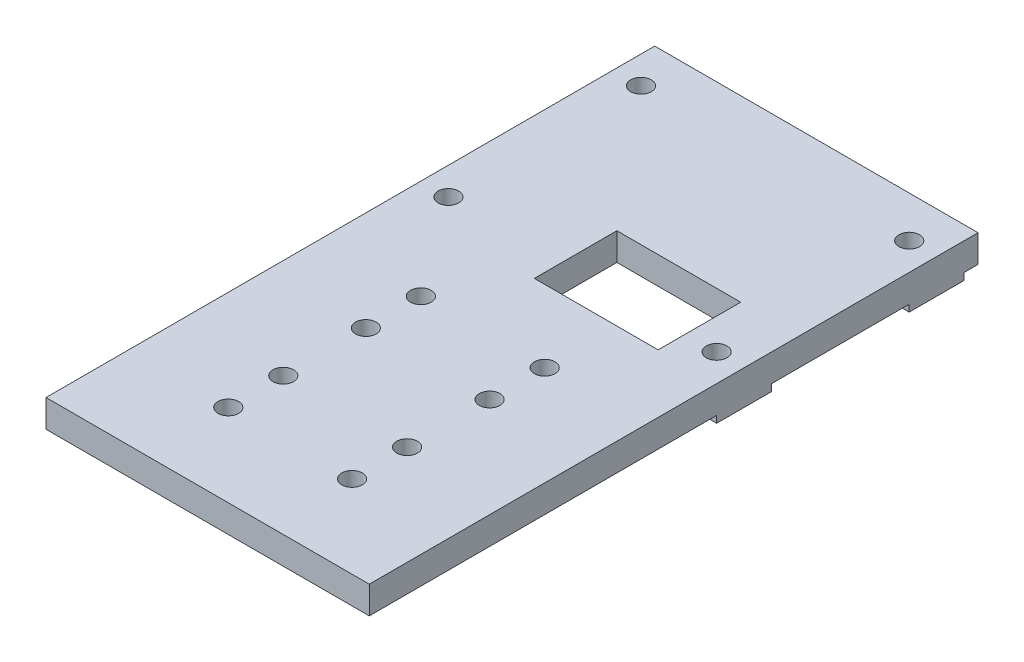
from build123d import *
from build123d.topology import SkipClean

# Parameters (mm, degrees)
SKETCH_1_W          = 47
SKETCH_1_H          = 93.5
SKETCH_1_R          = 1.5
SKETCH_1_W_2        = 18
SKETCH_1_H_2        = 12
EXTRUDE_1_DEPTH     = 4
EXTRUDE_START       = 1
SKETCH_3_W          = 8
SKETCH_3_H          = 8
SKETCH_3_R          = 1.5
EXTRUDE_2_DEPTH     = 1
SKETCH_4_R          = 1.5
SKETCH_4_W          = 47
SKETCH_4_H          = 5
CUT_EXTRUDE_2_DEPTH = 4


with BuildPart() as part:
    # 草图1 → 凸台-拉伸1 (new body)
    with BuildSketch(Plane(origin=(0, 0, 0), x_dir=(1, 0, 0), z_dir=(0, 1, 0))):
        with Locations((0, -26.75)):
            Rectangle(SKETCH_1_W, SKETCH_1_H)
        with Locations(Location((-19.5, -14, 0), (0, 0, 270))):
            Circle(SKETCH_1_R, mode=Mode.SUBTRACT)
        with Locations((6, -12)):
            Rectangle(SKETCH_1_W_2, SKETCH_1_H_2, mode=Mode.SUBTRACT)
        with Locations(Location((-19.5, 14, 0), (0, 0, 270))):
            Circle(SKETCH_1_R, mode=Mode.SUBTRACT)
        with Locations(Location((19.5, -14, 0), (0, 0, 270))):
            Circle(SKETCH_1_R, mode=Mode.SUBTRACT)
        with Locations(Location((19.5, 14, 0), (0, 0, 270))):
            Circle(SKETCH_1_R, mode=Mode.SUBTRACT)
    extrude(amount=EXTRUDE_1_DEPTH)

    # 草图3 → 凸台-拉伸2 (add)
    # profile 1 of 4: a face of its own
    with SkipClean():  # the faces are left unmerged after this step: merging them gives an invalid solid
        with BuildSketch(Plane.XZ.offset(EXTRUDE_START)):
            with Locations((19.5, -14)):
                Rectangle(SKETCH_3_W, SKETCH_3_H)
            with Locations(Location((19.5, -14, 0), (0, 0, 270))):
                Circle(SKETCH_3_R, mode=Mode.SUBTRACT)
        # profile 2 of 4: a face of its own
        with BuildSketch(Plane.XZ.offset(EXTRUDE_START)):
            with Locations((19.5, 14)):
                Rectangle(SKETCH_3_W, SKETCH_3_H)
            with Locations(Location((19.5, 14, 0), (0, 0, 270))):
                Circle(SKETCH_3_R, mode=Mode.SUBTRACT)
        # profile 3 of 4: a face of its own
        with BuildSketch(Plane.XZ.offset(EXTRUDE_START)):
            with Locations((-19.5, -14)):
                Rectangle(SKETCH_3_W, SKETCH_3_H)
            with Locations(Location((-19.5, -14, 0), (0, 0, 270))):
                Circle(SKETCH_3_R, mode=Mode.SUBTRACT)
        # profile 4 of 4: a face of its own
        with BuildSketch(Plane.XZ.offset(EXTRUDE_START)):
            with Locations((-19.5, 14)):
                Rectangle(SKETCH_3_W, SKETCH_3_H)
            with Locations(Location((-19.5, 14, 0), (0, 0, 270))):
                Circle(SKETCH_3_R, mode=Mode.SUBTRACT)
        extrude(amount=-EXTRUDE_2_DEPTH)

    # 草图4 → 切除-拉伸2 (cut)
    with SkipClean():  # the faces are left unmerged after this step: merging them gives an invalid solid
        with BuildSketch(Plane(origin=(0, 4, 0), x_dir=(1, 0, 0), z_dir=(0, 1, 0))):
            with Locations(Location((9, -28.5, 0), (0, 0, 270))):
                Circle(SKETCH_4_R)
            with Locations(Location((9, -48.5, 0), (0, 0, 270))):
                Circle(SKETCH_4_R)
            with Locations(Location((-9, -48.5, 0), (0, 0, 90))):
                Circle(SKETCH_4_R)
            with Locations(Location((-9, -28.5, 0), (0, 0, 90))):
                Circle(SKETCH_4_R)
            with Locations(Location((-9, -36.5, 0), (0, 0, 90))):
                Circle(SKETCH_4_R)
            with Locations(Location((9, -36.5, 0), (0, 0, 270))):
                Circle(SKETCH_4_R)
            with Locations(Location((9, -56.5, 0), (0, 0, 270))):
                Circle(SKETCH_4_R)
            with Locations(Location((-9, -56.5, 0), (0, 0, 90))):
                Circle(SKETCH_4_R)
            with Locations((0, -71)):
                Rectangle(SKETCH_4_W, SKETCH_4_H)
        extrude(amount=-CUT_EXTRUDE_2_DEPTH, mode=Mode.SUBTRACT)


solid = part.part
